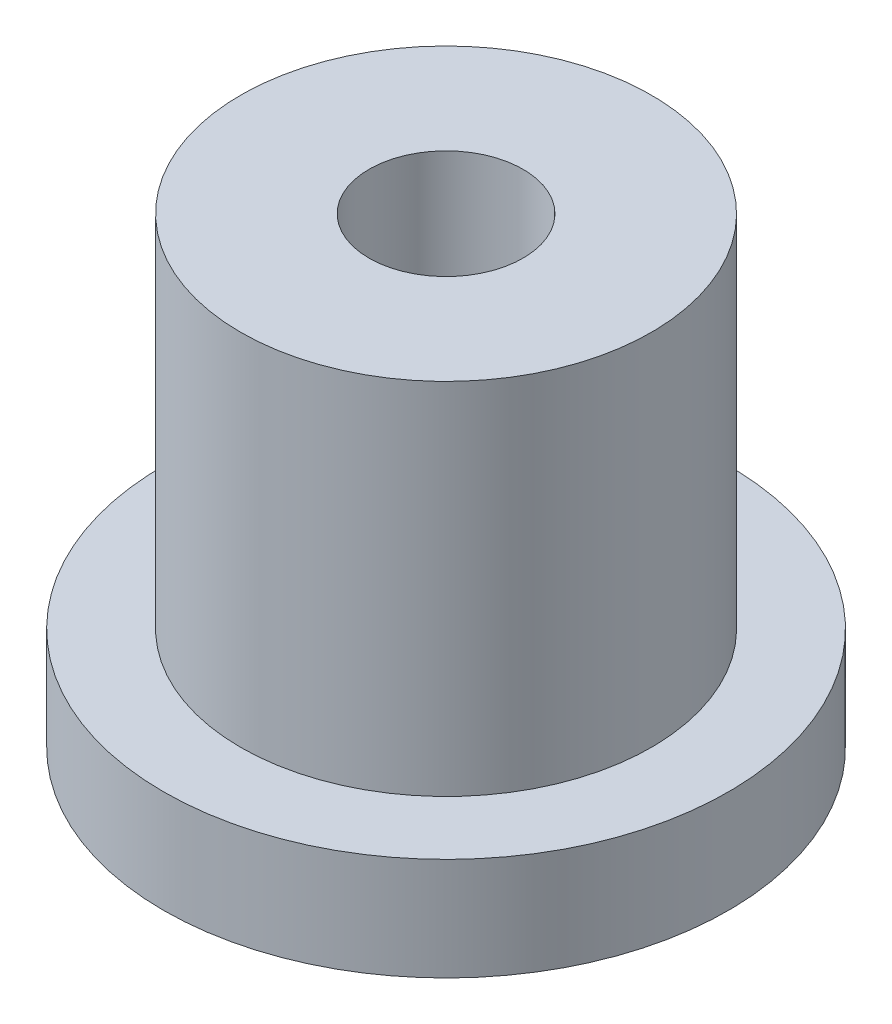
from build123d import *

# Parameters (mm, degrees)
SKETCH1_R           = 5.5
SKETCH1_R_2         = 1.5
BOSS_EXTRUDE1_DEPTH = 2
SKETCH2_R           = 4
SKETCH2_R_2         = 1.5
BOSS_EXTRUDE2_DEPTH = 7


with BuildPart() as part:
    # Sketch1 → Boss-Extrude1 (new body)
    with BuildSketch(Plane(origin=(0, 0, 0), x_dir=(1, 0, 0), z_dir=(0, 1, 0))):
        with Locations(Location((0, 0, 0), (0, 0, 270))):
            Circle(SKETCH1_R)
        with Locations(Location((0, 0, 0), (0, 0, 270))):
            Circle(SKETCH1_R_2, mode=Mode.SUBTRACT)
    extrude(amount=BOSS_EXTRUDE1_DEPTH)

    # Sketch2 → Boss-Extrude2 (add)
    with BuildSketch(Plane(origin=(0, 2, 0), x_dir=(1, 0, 0), z_dir=(0, 1, 0))):
        with Locations(Location((0, 0, 0), (0, 0, 270))):
            Circle(SKETCH2_R)
        with Locations(Location((0, 0, 0), (0, 0, 270))):
            Circle(SKETCH2_R_2, mode=Mode.SUBTRACT)
    extrude(amount=BOSS_EXTRUDE2_DEPTH)


solid = part.part
